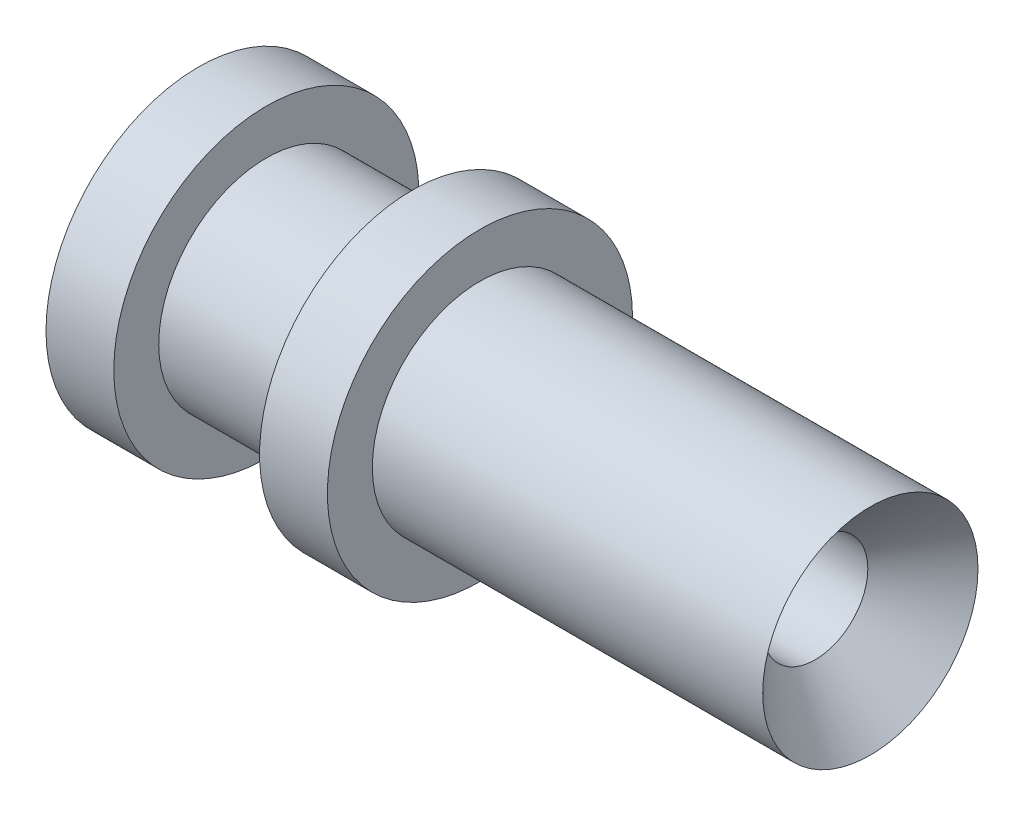
from build123d import *

# Parameters (mm, degrees)
SKETCH1_R                     = 3.175
BOSS_EXTRUDE1_DEPTH           = 18
SKETCH4_R                     = 4.5
BOSS_EXTRUDE2_DEPTH           = 2
BOSS_EXTRUDE3_START           = -6.3
SKETCH4_3_R                   = 4.5
BOSS_EXTRUDE3_DEPTH           = 2
CUT_EXTRUDE3_DEPTH            = 21.988091862
CUT_EXTRUDE3_DEPTH_BACK       = 21.988091862
SKETCH5_R                     = 1.5
CUT_EXTRUDE4_DEPTH            = 21.988091862
CUT_EXTRUDE4_DEPTH_BACK       = 1
CSK_FOR_M3_SFHCS1_D           = 3.1
CSK_FOR_M3_SFHCS1_DEPTH       = 25.068666041
CSK_FOR_M3_SFHCS1_CSINK_D     = 6.72
CSK_FOR_M3_SFHCS1_CSINK_ANGLE = 90
CSK_FOR_M3_SFHCS1_TIP         = 0.931333959


with BuildPart() as part:
    # Sketch1 → Boss-Extrude1 (new body)
    with BuildSketch(Plane(origin=(0, 0, 0), x_dir=(0, 0, -1), z_dir=(1, 0, 0))):
        Circle(SKETCH1_R)
    extrude(amount=BOSS_EXTRUDE1_DEPTH)

    # Sketch4 → Boss-Extrude2 (add)
    with BuildSketch(Plane.ZY):
        Circle(SKETCH4_R)
    extrude(amount=BOSS_EXTRUDE2_DEPTH)

    # Sketch4<3> → Boss-Extrude3 (add)
    with BuildSketch(Plane.ZY.offset(BOSS_EXTRUDE3_START)):
        Circle(SKETCH4_3_R)
    extrude(amount=BOSS_EXTRUDE3_DEPTH)

    # Sketch5 → Cut-Extrude3 (cut, two sides: drawn at the far end of the back side and taken through both)
    with BuildSketch(Plane.ZY.offset(2).offset(-CUT_EXTRUDE3_DEPTH_BACK)):
        Circle(SKETCH5_R)
    extrude(amount=CUT_EXTRUDE3_DEPTH + CUT_EXTRUDE3_DEPTH_BACK, mode=Mode.SUBTRACT)

    # Sketch6 → Cut-Extrude4 (cut, two sides: drawn at the far end of the back side and taken through both)
    with BuildSketch(Plane.ZY.offset(2).offset(-CUT_EXTRUDE4_DEPTH_BACK)):
        Polygon((2.8, -1.616580754), (2.8, 1.616580754), (0, 3.233161507), (-2.8, 1.616580754), (-2.8, -1.616580754), (0, -3.233161507), align=None)
    extrude(amount=CUT_EXTRUDE4_DEPTH + CUT_EXTRUDE4_DEPTH_BACK, mode=Mode.SUBTRACT)

    # CSK for M3 SFHCS1
    with Locations(Plane(origin=(18, 0, 0), x_dir=(0, 0, -1), z_dir=(1, 0, 0))):
        with Locations((0, 0)):
            CounterSinkHole(CSK_FOR_M3_SFHCS1_D / 2, CSK_FOR_M3_SFHCS1_CSINK_D / 2, depth=CSK_FOR_M3_SFHCS1_DEPTH, counter_sink_angle=CSK_FOR_M3_SFHCS1_CSINK_ANGLE)
            with Locations((0, 0, -(CSK_FOR_M3_SFHCS1_DEPTH + CSK_FOR_M3_SFHCS1_TIP / 2))):  # 118° drill point
                Cone(0, CSK_FOR_M3_SFHCS1_D / 2, CSK_FOR_M3_SFHCS1_TIP, mode=Mode.SUBTRACT)


solid = part.part
